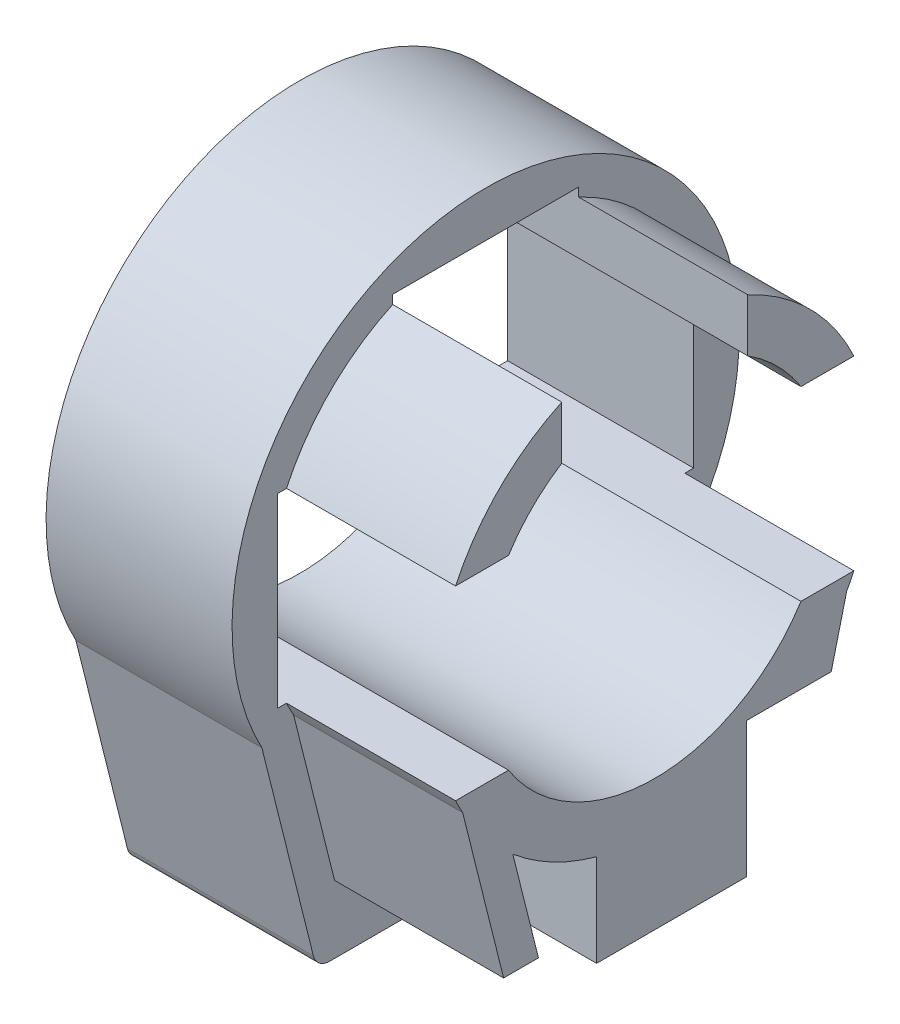
from build123d import *

# Parameters (mm, degrees)
CROQUIS1_R              = 10
SALIENTE_EXTRUIR1_DEPTH = 11
CROQUIS2_R              = 10
SALIENTE_EXTRUIR2_DEPTH = 10
CORTAR_EXTRUIR3_START   = -10
CORTAR_EXTRUIR3_DEPTH   = 10
CROQUIS8_R              = 1.55
CORTAR_EXTRUIR4_DEPTH   = 5
CORTAR_EXTRUIR8_REACH   = 52.656
CORTAR_EXTRUIR9_START   = -10
CORTAR_EXTRUIR9_DEPTH   = 10


with BuildPart() as part:
    # Croquis1 → Saliente-Extruir1 (new body)
    with BuildSketch(Plane(origin=(0, 0, 0), x_dir=(0, 0, -1), z_dir=(1, 0, 0))):
        with BuildLine():
            Line((-5.780776406, 0), (-24.219223594, 0))
            ThreePointArc((-24.219223594, 0), (-24.834635803, 0.211794562), (-25.189366094, 0.757464375))
            Line((-25.189366094, 0.757464375), (-28.235294118, 12.941176471))
            ThreePointArc((-28.235294118, 12.941176471), (-15, 35), (-1.764705882, 12.941176471))
            Line((-1.764705882, 12.941176471), (-4.810633906, 0.757464375))
            ThreePointArc((-4.810633906, 0.757464375), (-5.165364197, 0.211794562), (-5.780776406, 0))
        make_face()
        with Locations((-15, 20)):
            Circle(CROQUIS1_R, mode=Mode.SUBTRACT)
    extrude(amount=SALIENTE_EXTRUIR1_DEPTH)

    # Croquis2 → Saliente-Extruir2 (add)
    with BuildSketch(Plane(origin=(11, 0, 0), x_dir=(0, 0, -1), z_dir=(1, 0, 0))):
        with BuildLine():
            Line((-23.438447187, 2), (-6.561552813, 2))
            Line((-6.561552813, 2), (-3.643105675, 13.673788552))
            ThreePointArc((-3.643105675, 13.673788552), (-15, 33), (-26.356894325, 13.673788552))
            Line((-26.356894325, 13.673788552), (-23.438447187, 2))
        make_face()
        with Locations((-15, 20)):
            Circle(CROQUIS2_R, mode=Mode.SUBTRACT)
    extrude(amount=SALIENTE_EXTRUIR2_DEPTH)

    # Croquis3 → Cortar-Extruir3 (cut)
    with BuildSketch(Plane(origin=(21, 0, 0), x_dir=(0, 0, -1), z_dir=(1, 0, 0)).offset(CORTAR_EXTRUIR3_START)):
        Polygon((-9.561552813, 2), (-9.561552813, 10), (-4.561552813, 10), (-6.561552813, 2), align=None)
        with BuildLine():
            Line((-23.438447187, 2), (-18.438447187, 2))
            Line((-18.438447187, 2), (-18.438447187, 6.945227656))
            Line((-18.438447187, 6.945227656), (-18.438447187, 7.462971606))
            ThreePointArc((-18.438447187, 7.462971606), (-21.059353424, 8.498511571), (-23.395524099, 10.074518898))
            Line((-23.395524099, 10.074518898), (-23.194590952, 9.270786312))
            Line((-23.194590952, 9.270786312), (-21.876894374, 4))
            Line((-21.876894374, 4), (-23.938447187, 4))
            Line((-23.938447187, 4), (-23.438447187, 2))
        make_face()
    extrude(amount=CORTAR_EXTRUIR3_DEPTH, mode=Mode.SUBTRACT)

    # Croquis8 → Cortar-Extruir4 (cut)
    with BuildSketch(Plane.XZ.offset(-2)):
        with Locations(Location((16, 14, 0), (0, 0, 270))):
            Circle(CROQUIS8_R)
    extrude(amount=-CORTAR_EXTRUIR4_DEPTH, mode=Mode.SUBTRACT)

    # Croquis10 → Cortar-Extruir8 (cut, up to next)
    with BuildSketch(Plane.ZY, mode=Mode.PRIVATE) as cortar_extruir8_sk1:
        with BuildLine():
            Line((15, 32.3), (20.5, 32.3))
            Line((20.5, 32.3), (20.5, 28.649421946))
            ThreePointArc((20.5, 28.649421946), (22.247844507, 27.247844507), (23.649421946, 25.5))
            Line((23.649421946, 25.5), (27.3, 25.5))
            Line((27.3, 25.5), (27.3, 20))
            Line((27.3, 20), (27.3, 14.5))
            Line((27.3, 14.5), (23.649421946, 14.5))
            ThreePointArc((23.649421946, 14.5), (15, 9.75), (6.350578054, 14.5))
            Line((6.350578054, 14.5), (2.7, 14.5))
            Line((2.7, 14.5), (2.7, 20))
            Line((2.7, 20), (2.7, 25.5))
            Line((2.7, 25.5), (6.350578054, 25.5))
            ThreePointArc((6.350578054, 25.5), (7.752155493, 27.247844507), (9.5, 28.649421946))
            Line((9.5, 28.649421946), (9.5, 32.3))
            Line((9.5, 32.3), (15, 32.3))
        make_face()
    cortar_extruir8_tool1 = extrude(cortar_extruir8_sk1.sketch, amount=-CORTAR_EXTRUIR8_REACH, mode=Mode.PRIVATE) & part.part
    add(cortar_extruir8_tool1.solids().sort_by_distance((0, 20.746773, 15))[0], mode=Mode.SUBTRACT)

    # Croquis12 → Cortar-Extruir9 (cut)
    with BuildSketch(Plane(origin=(21, 0, 0), x_dir=(0, 0, -1), z_dir=(1, 0, 0)).offset(CORTAR_EXTRUIR9_START)):
        with BuildLine():
            Line((-19.208325083, 32.3), (-10.791674918, 32.3))
            ThreePointArc((-10.791674918, 32.3), (-15, 33), (-19.208325083, 32.3))
        make_face()
        with BuildLine():
            Line((-27.3, 15.791674917), (-27.3, 24.208325082))
            ThreePointArc((-27.3, 24.208325082), (-28, 20), (-27.3, 15.791674917))
        make_face()
        with BuildLine():
            Line((-2.7, 24.208325083), (-2.7, 15.791674917))
            ThreePointArc((-2.7, 15.791674917), (-2, 20), (-2.7, 24.208325083))
        make_face()
    extrude(amount=CORTAR_EXTRUIR9_DEPTH, mode=Mode.SUBTRACT)


solid = part.part
